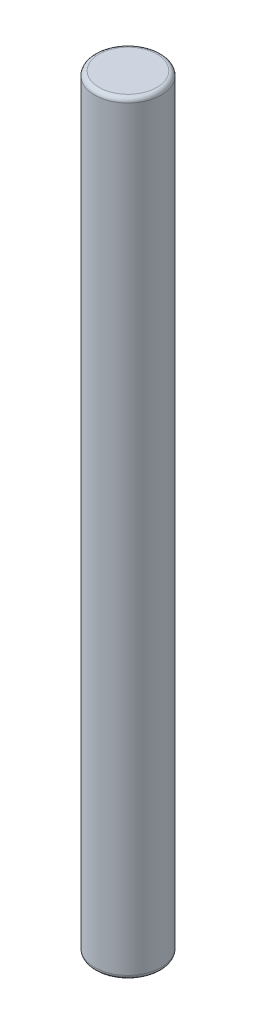
from build123d import *

# Parameters (mm, degrees)
SKETCH1_R           = 7.5
BOSS_EXTRUDE1_DEPTH = 172
FILLET1_R           = 1


with BuildPart() as part:
    # Sketch1 → Boss-Extrude1 (new body)
    with BuildSketch(Plane(origin=(0, 0, 0), x_dir=(1, 0, 0), z_dir=(0, 1, 0))):
        Circle(SKETCH1_R)
    extrude(amount=BOSS_EXTRUDE1_DEPTH)

    # Fillet1
    fillet1_edges = [part.edges().sort_by_distance(p)[0] for p in [
        (-7.5, 0, 0),
        (-7.5, 172, 0),
    ]]
    fillet(fillet1_edges, radius=FILLET1_R)


solid = part.part
